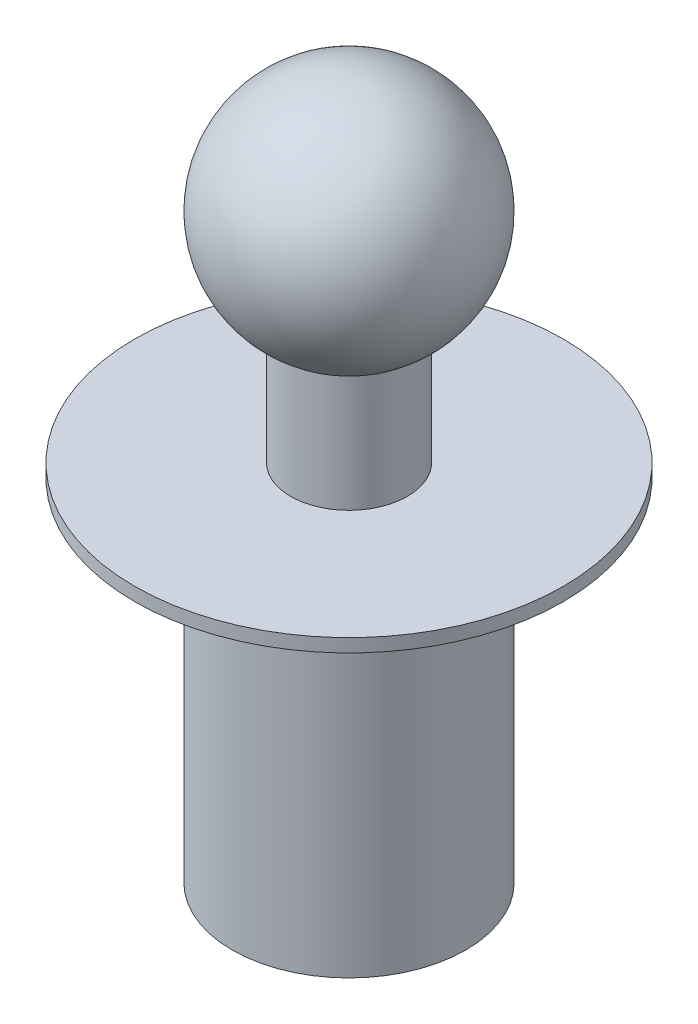
from build123d import *


with BuildPart() as part:
    # Esquisse1 → Révolution1 (revolve)
    with BuildSketch(Plane.XY, mode=Mode.PRIVATE) as r_volution1_sk:
        with BuildLine():
            Line((0, -3), (1, -3))
            Line((1, -3), (1, 0))
            Line((1, 0), (1.834577761, 0))
            Line((1.834577761, 0), (1.834577761, 0.113786684))
            Line((1.834577761, 0.113786684), (0.5, 0.113786684))
            Line((0.5, 0.113786684), (0.5, 1.113786684))
            ThreePointArc((0.5, 1.113786684), (0.965925826, 2.238631132), (0, 2.979812087))
            Line((0, 2.979812087), (0, -3))
        make_face()
    revolve(r_volution1_sk.sketch.rotate(Axis((0, -3, 0), (0, 1, 0)), 90), axis=Axis((0, -3, 0), (0, 1, 0)))


solid = part.part
